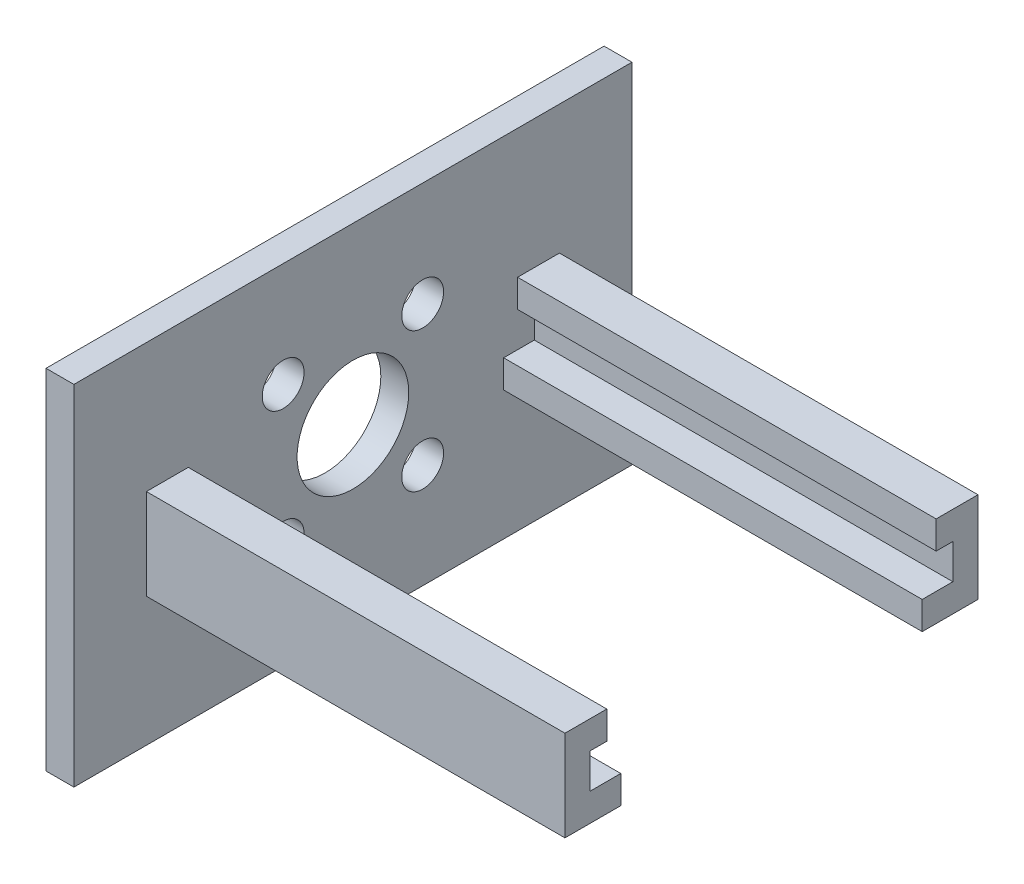
from build123d import *

# Parameters (mm, degrees)
SKETCH1_W           = 40
SKETCH1_H           = 25
BOSS_EXTRUDE1_DEPTH = 1
SKETCH2_W           = 40
SKETCH2_H           = 25
BOSS_EXTRUDE2_DEPTH = 1
BOSS_EXTRUDE3_DEPTH = 30
SKETCH5_R           = 1.5
SKETCH5_R_2         = 4
CUT_EXTRUDE2_DEPTH  = 10


with BuildPart() as part:
    # Sketch1 → Boss-Extrude1 (new body)
    with BuildSketch(Plane(origin=(0, 0, 0), x_dir=(0, 0, -1), z_dir=(1, 0, 0))):
        Rectangle(SKETCH1_W, SKETCH1_H)
    extrude(amount=BOSS_EXTRUDE1_DEPTH)

    # Sketch2 → Boss-Extrude2 (add)
    with BuildSketch(Plane(origin=(1, 0, 0), x_dir=(0, 0, -1), z_dir=(1, 0, 0))):
        Rectangle(SKETCH2_W, SKETCH2_H)
    extrude(amount=BOSS_EXTRUDE2_DEPTH)

    # Sketch3 → Boss-Extrude3 (add)
    with BuildSketch(Plane(origin=(2, 0, 0), x_dir=(0, 0, -1), z_dir=(1, 0, 0))):
        Polygon((11.802707793, 1.25), (11.802707793, 3.25), (14.802707793, 3.25), (14.802707793, -3.25), (10.802707793, -3.25), (10.802707793, -1.25), (13, -1.25), (13, 1.25), align=None)
        Polygon((-13, -1.25), (-13, 1.25), (-11.802707793, 1.25), (-11.802707793, 3.25), (-14.802707793, 3.25), (-14.802707793, -3.25), (-10.802707793, -3.25), (-10.802707793, -1.25), align=None)
    extrude(amount=BOSS_EXTRUDE3_DEPTH)

    # Sketch5 → Cut-Extrude2 (cut)
    with BuildSketch(Plane(origin=(2, 0, 0), x_dir=(0, 0, -1), z_dir=(1, 0, 0))):
        with Locations((5, 5)):
            Circle(SKETCH5_R)
        with Locations((5, -5)):
            Circle(SKETCH5_R)
        with Locations((-5, -5)):
            Circle(SKETCH5_R)
        with Locations((-5, 5)):
            Circle(SKETCH5_R)
        Circle(SKETCH5_R_2)
    extrude(amount=-CUT_EXTRUDE2_DEPTH, mode=Mode.SUBTRACT)


solid = part.part
